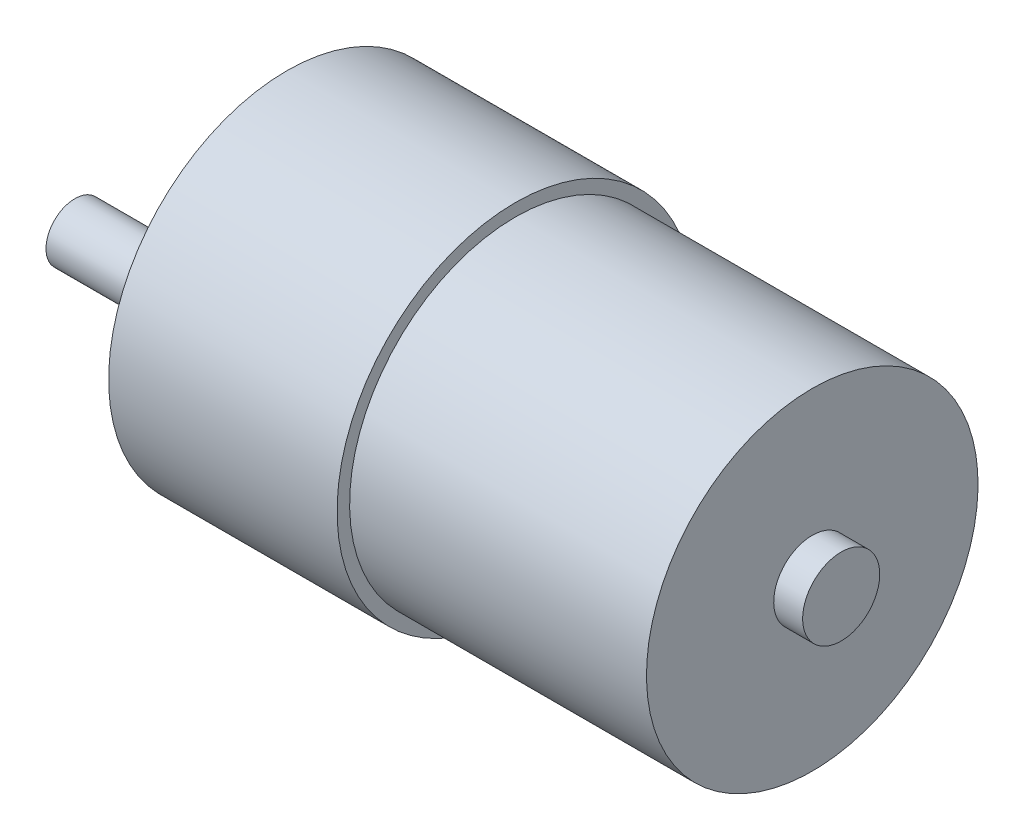
from build123d import *

# Parameters (mm, degrees)
SKETCH1_W           = 23.7
SKETCH1_H           = 18.5
SKETCH1_W_2         = 3
SKETCH1_H_2         = 4
SKETCH2_R           = 6.5
BOSS_EXTRUDE1_DEPTH = 7
SKETCH3_R           = 3
BOSS_EXTRUDE2_DEPTH = 15


with BuildPart() as part:
    # Sketch1 → Revolve1 (revolve)
    with BuildSketch(Plane.XY):
        with Locations((-11.85, 9.25)):
            Rectangle(SKETCH1_W, SKETCH1_H)
        Polygon((30.8, 17.2), (0, 17.2), (0, 0), (30.8, 0), (30.8, 4), align=None)
        with Locations((32.3, 2)):
            Rectangle(SKETCH1_W_2, SKETCH1_H_2)
    revolve(axis=Axis((30.8, 0, 0), (-1, 0, 0)))

    # Sketch2 → Boss-Extrude1 (add)
    with BuildSketch(Plane.ZY.offset(23.7)):
        with Locations(Location((0, -7, 0), (0, 0, 270))):
            Circle(SKETCH2_R)
    extrude(amount=BOSS_EXTRUDE1_DEPTH)

    # Sketch3 → Boss-Extrude2 (add)
    with BuildSketch(Plane.ZY.offset(30.7)):
        with Locations(Location((0, -7, 0), (0, 0, 270))):
            Circle(SKETCH3_R)
    extrude(amount=BOSS_EXTRUDE2_DEPTH)


solid = part.part
